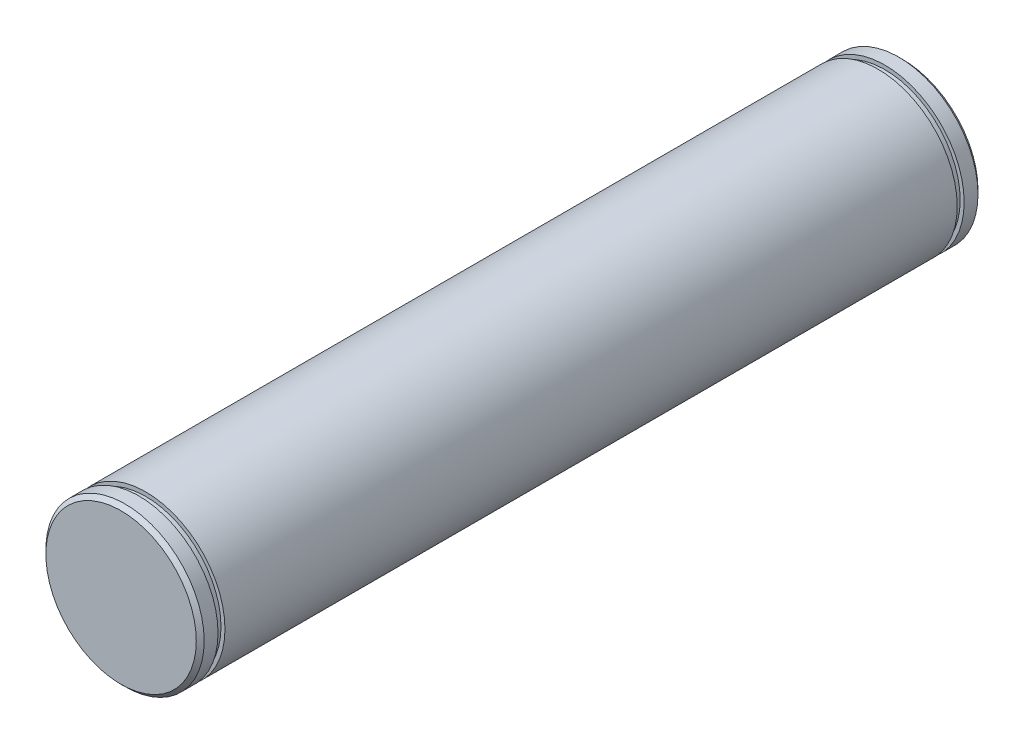
from build123d import *

# Parameters (mm, degrees)
SKETCH_1_R      = 4
EXTRUDE_1_DEPTH = 19.75
SKETCH_2_W      = 0.35
SKETCH_2_H      = 0.2
CHAMFER_1_SIZE  = 0.2


with BuildPart() as part:
    # 草图1 → 凸台-拉伸1 (new, symmetric)
    with BuildSketch(Plane.XY):
        Circle(SKETCH_1_R)
    extrude(amount=EXTRUDE_1_DEPTH, both=True)

    # 草图2 → 切除-旋转1 (revolve, cut)
    with BuildSketch(Plane(origin=(0, 0, 0), x_dir=(0, 0, -1), z_dir=(1, 0, 0)), mode=Mode.PRIVATE) as cut_revolve_1_sk:
        with Locations((-18.675, 3.9)):
            Rectangle(SKETCH_2_W, SKETCH_2_H)
        with Locations((18.675, 3.9)):
            Rectangle(SKETCH_2_W, SKETCH_2_H)
    revolve(cut_revolve_1_sk.sketch.rotate(Axis((0, 0, 19.75), (0, 0, -1)), 90), axis=Axis((0, 0, 19.75), (0, 0, -1)), mode=Mode.SUBTRACT)

    # 倒角1
    chamfer_1_edges = [part.edges().sort_by_distance(p)[0] for p in [
        (-4, 0, -19.75),
        (-4, 0, 19.75),
    ]]
    chamfer(chamfer_1_edges, length=CHAMFER_1_SIZE)


solid = part.part
